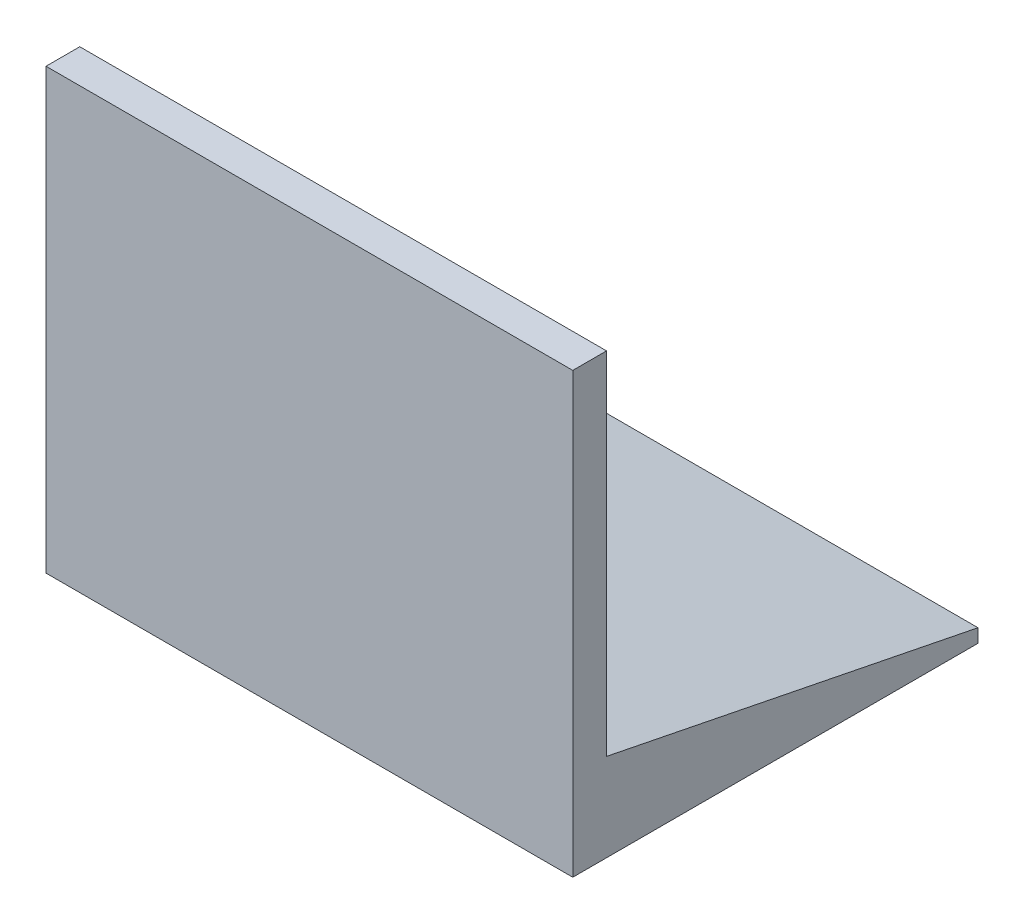
from build123d import *

# Parameters (mm, degrees)
BOSS_EXTRUDE1_DEPTH = 390


with BuildPart() as part:
    # Sketch1 → Boss-Extrude1 (new body)
    with BuildSketch(Plane(origin=(0, 0, 0), x_dir=(0, 0, -1), z_dir=(1, 0, 0))):
        Polygon((25, 325), (0, 325), (0, 0), (300, 0), (300, 10), (25, 65), align=None)
    extrude(amount=BOSS_EXTRUDE1_DEPTH)


solid = part.part
